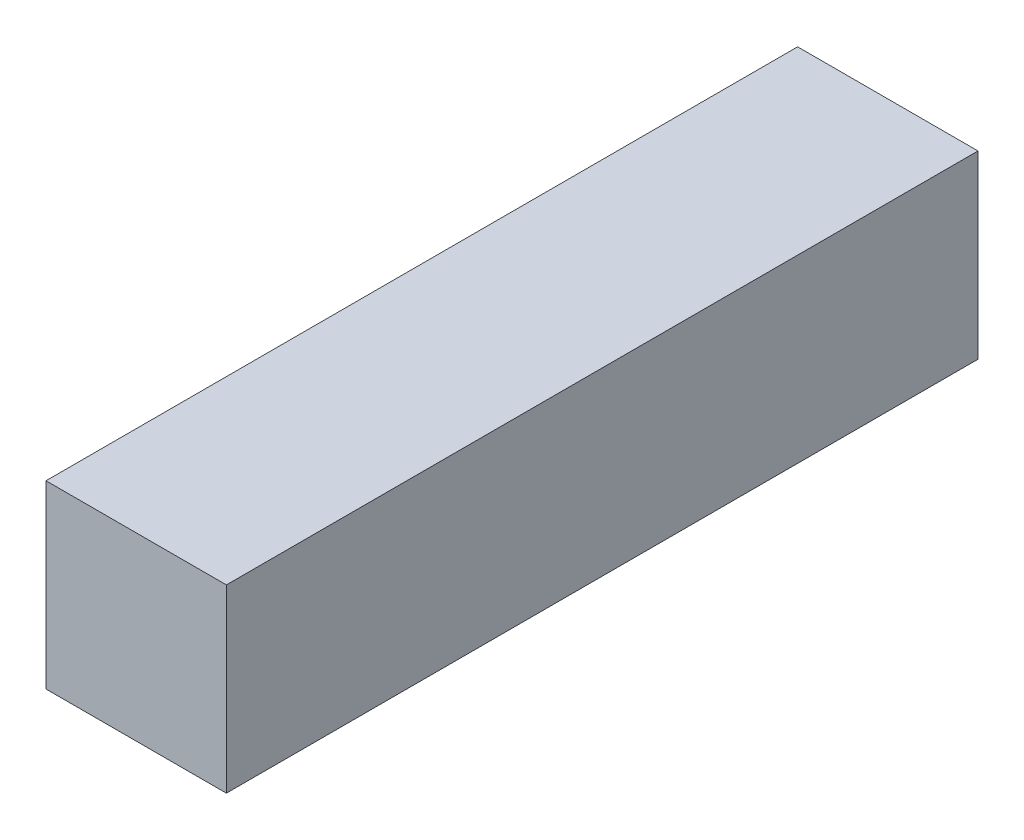
from build123d import *

# Parameters (mm, degrees)
SKETCH1_W           = 152.4
SKETCH1_H           = 152.4
BOSS_EXTRUDE1_DEPTH = 635


with BuildPart() as part:
    # Sketch1 → Boss-Extrude1 (new body)
    with BuildSketch(Plane.XY):
        Rectangle(SKETCH1_W, SKETCH1_H)
    extrude(amount=BOSS_EXTRUDE1_DEPTH)


solid = part.part
